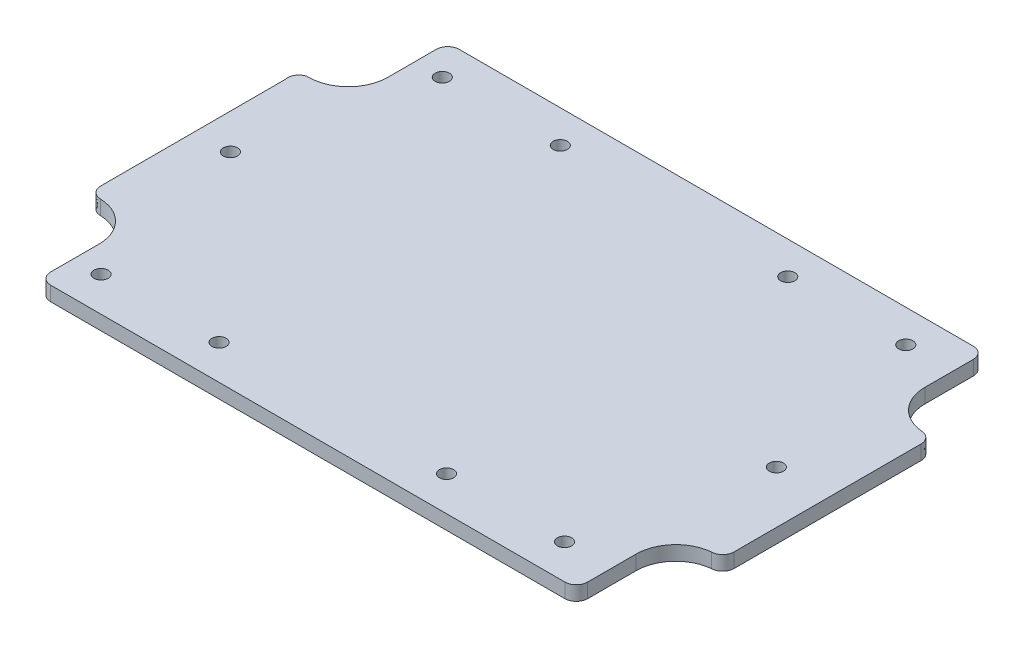
from build123d import *

# Parameters (mm, degrees)
BOSS_EXTRUDE2_DEPTH = 2.54


with BuildPart() as part:
    # Sketch1 → Boss-Extrude2 (new body)
    with BuildSketch(Plane(origin=(0, -3.804704038, 0), x_dir=(1, 0, 0), z_dir=(0, 1, 0))):
        with BuildLine():
            Line((57.814610393, -1.399255471), (57.814610393, 31.463731379))
            add(Edge.make_bspline(
                [(57.814610393, 31.463731379), (57.81461039, 31.720749656), (57.713354059, 32.24087993), (57.283601426, 32.898996274), (56.638589176, 33.350770599), (56.123774909, 33.468351967), (55.867443389, 33.476897959)],
                knots=[0, 0, 0, 0, 0.001152389, 0.002304779, 0.003457168, 0.004609557, 0.004609557, 0.004609557, 0.004609557], degree=3))
            ThreePointArc((55.867443389, 33.476897959), (51.352854042, 35.727909928), (49.531351994, 40.432237951))
            Line((49.531351994, 40.432237951), (49.531351994, 48.932237951))
            ThreePointArc((49.531351994, 48.932237951), (48.94134809, 50.356633378), (47.516952663, 50.946637283))
            Line((47.516952663, 50.946637283), (-42.883047337, 50.946637283))
            ThreePointArc((-42.883047337, 50.946637283), (-44.307442765, 50.356633378), (-44.897446669, 48.932237951))
            Line((-44.897446669, 48.932237951), (-44.897446669, 40.432237951))
            ThreePointArc((-44.897446669, 40.432237951), (-47.052603702, 35.385909486), (-52.188281684, 33.453309044))
            add(Edge.make_bspline(
                [(-52.188281684, 33.453309044), (-52.43565379, 33.383556369), (-52.908782875, 33.144941164), (-53.425568037, 32.552710177), (-53.685335706, 31.809298042), (-53.65878771, 31.281894674), (-53.597446669, 31.032864237)],
                knots=[0, 0, 0, 0, 0.001152389, 0.002304779, 0.003457168, 0.004609557, 0.004609557, 0.004609557, 0.004609557], degree=3))
            Line((-53.597446669, 31.032864237), (-53.597446669, -1.372873912))
            add(Edge.make_bspline(
                [(-53.597446669, -1.372873912), (-53.597446666, -1.629892189), (-53.496190335, -2.150022463), (-53.066437702, -2.808138807), (-52.421425452, -3.259913132), (-51.906611185, -3.3774945), (-51.650279665, -3.386040492)],
                knots=[0, 0, 0, 0, 0.001152389, 0.002304779, 0.003457168, 0.004609557, 0.004609557, 0.004609557, 0.004609557], degree=3))
            ThreePointArc((-51.650279665, -3.386040492), (-46.861860291, -5.511189457), (-44.897446669, -10.367762049))
            Line((-44.897446669, -10.367762049), (-44.897446669, -18.867762049))
            ThreePointArc((-44.897446669, -18.867762049), (-44.307442765, -20.292157477), (-42.883047337, -20.882161381))
            Line((-42.883047337, -20.882161381), (47.516952663, -20.882161381))
            ThreePointArc((47.516952663, -20.882161381), (48.94134809, -20.292157477), (49.531351994, -18.867762049))
            Line((49.531351994, -18.867762049), (49.531351994, -10.367762049))
            ThreePointArc((49.531351994, -10.367762049), (51.352854045, -5.663434025), (55.867443396, -3.412422057))
            add(Edge.make_bspline(
                [(55.867443396, -3.412422057), (56.12431895, -3.403857932), (56.640786427, -3.285326537), (57.284217505, -2.833883412), (57.714248467, -2.174175738), (57.814610385, -1.655729411), (57.814610393, -1.399255471)],
                knots=[0, 0, 0, 0, 0.001152389, 0.002304779, 0.003457168, 0.004609557, 0.004609557, 0.004609557, 0.004609557], degree=3))
        make_face()
        with BuildLine():
            ThreePointArc((20.629561635, 43.959437934), (21.879561635, 45.209437934), (20.629561635, 46.459437934))
            ThreePointArc((20.629561635, 46.459437934), (19.379561635, 45.209437934), (20.629561635, 43.959437934))
        make_face(mode=Mode.SUBTRACT)
        with BuildLine():
            ThreePointArc((41.379561635, 43.959437934), (42.629561635, 45.209437934), (41.379561635, 46.459437934))
            ThreePointArc((41.379561635, 46.459437934), (40.129561635, 45.209437934), (41.379561635, 43.959437934))
        make_face(mode=Mode.SUBTRACT)
        with BuildLine():
            ThreePointArc((48.629561635, 16.459437934), (47.379561635, 15.209437934), (48.629561635, 13.959437934))
            ThreePointArc((48.629561635, 13.959437934), (49.879561635, 15.209437934), (48.629561635, 16.459437934))
        make_face(mode=Mode.SUBTRACT)
        with BuildLine():
            ThreePointArc((41.379561635, -13.540562066), (40.129561635, -14.790562066), (41.379561635, -16.040562066))
            ThreePointArc((41.379561635, -16.040562066), (42.629561635, -14.790562066), (41.379561635, -13.540562066))
        make_face(mode=Mode.SUBTRACT)
        with BuildLine():
            ThreePointArc((20.629561635, -13.540562066), (19.379561635, -14.790562066), (20.629561635, -16.040562066))
            ThreePointArc((20.629561635, -16.040562066), (21.879561635, -14.790562066), (20.629561635, -13.540562066))
        make_face(mode=Mode.SUBTRACT)
        with BuildLine():
            ThreePointArc((-19.370438365, -13.540562066), (-20.620438365, -14.790562066), (-19.370438365, -16.040562066))
            ThreePointArc((-19.370438365, -16.040562066), (-18.120438365, -14.790562066), (-19.370438365, -13.540562066))
        make_face(mode=Mode.SUBTRACT)
        with BuildLine():
            ThreePointArc((-40.120438365, -16.040562066), (-38.870438365, -14.790562066), (-40.120438365, -13.540562066))
            ThreePointArc((-40.120438365, -13.540562066), (-41.370438365, -14.790562066), (-40.120438365, -16.040562066))
        make_face(mode=Mode.SUBTRACT)
        with BuildLine():
            ThreePointArc((-47.370438365, 13.959437934), (-46.120438365, 15.209437934), (-47.370438365, 16.459437934))
            ThreePointArc((-47.370438365, 16.459437934), (-48.620438365, 15.209437934), (-47.370438365, 13.959437934))
        make_face(mode=Mode.SUBTRACT)
        with BuildLine():
            ThreePointArc((-40.120438365, 43.959437934), (-38.870438365, 45.209437934), (-40.120438365, 46.459437934))
            ThreePointArc((-40.120438365, 46.459437934), (-41.370438365, 45.209437934), (-40.120438365, 43.959437934))
        make_face(mode=Mode.SUBTRACT)
        with BuildLine():
            ThreePointArc((-19.370438365, 43.959437934), (-18.120438365, 45.209437934), (-19.370438365, 46.459437934))
            ThreePointArc((-19.370438365, 46.459437934), (-20.620438365, 45.209437934), (-19.370438365, 43.959437934))
        make_face(mode=Mode.SUBTRACT)
    extrude(amount=BOSS_EXTRUDE2_DEPTH)


solid = part.part
